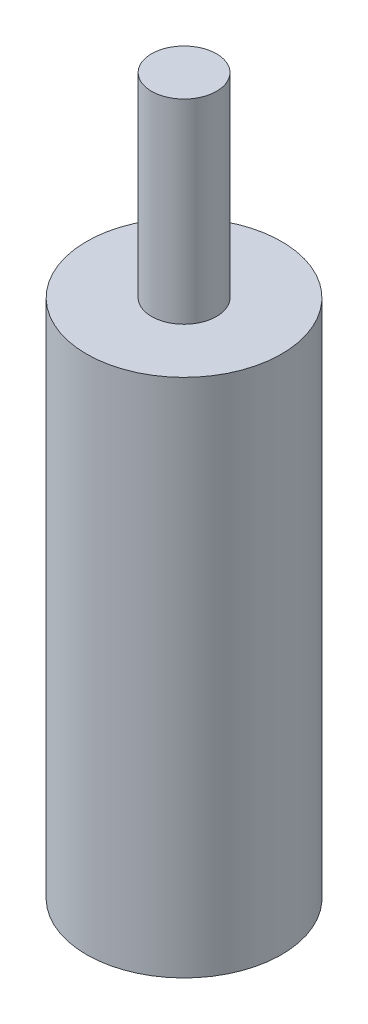
from build123d import *

# Parameters (mm, degrees)
SKETCH1_R           = 4.7625
BOSS_EXTRUDE1_DEPTH = 25.4
SKETCH2_R           = 1.5875
BOSS_EXTRUDE2_DEPTH = 9.525
SKETCH3_R           = 1.5875
CUT_EXTRUDE1_DEPTH  = 9.525


with BuildPart() as part:
    # Sketch1 → Boss-Extrude1 (new body)
    with BuildSketch(Plane(origin=(0, 0, 0), x_dir=(1, 0, 0), z_dir=(0, 1, 0))):
        with Locations(Location((0, 0, 0), (0, 0, 270))):
            Circle(SKETCH1_R)
    extrude(amount=BOSS_EXTRUDE1_DEPTH)

    # Sketch2 → Boss-Extrude2 (add)
    with BuildSketch(Plane(origin=(0, 25.4, 0), x_dir=(1, 0, 0), z_dir=(0, 1, 0))):
        with Locations(Location((0, 0, 0), (0, 0, 90))):
            Circle(SKETCH2_R)
    extrude(amount=BOSS_EXTRUDE2_DEPTH)

    # Sketch3 → Cut-Extrude1 (cut)
    with BuildSketch(Plane.XZ):
        with Locations(Location((0, 0, 0), (0, 0, 270))):
            Circle(SKETCH3_R)
    extrude(amount=-CUT_EXTRUDE1_DEPTH, mode=Mode.SUBTRACT)


solid = part.part
